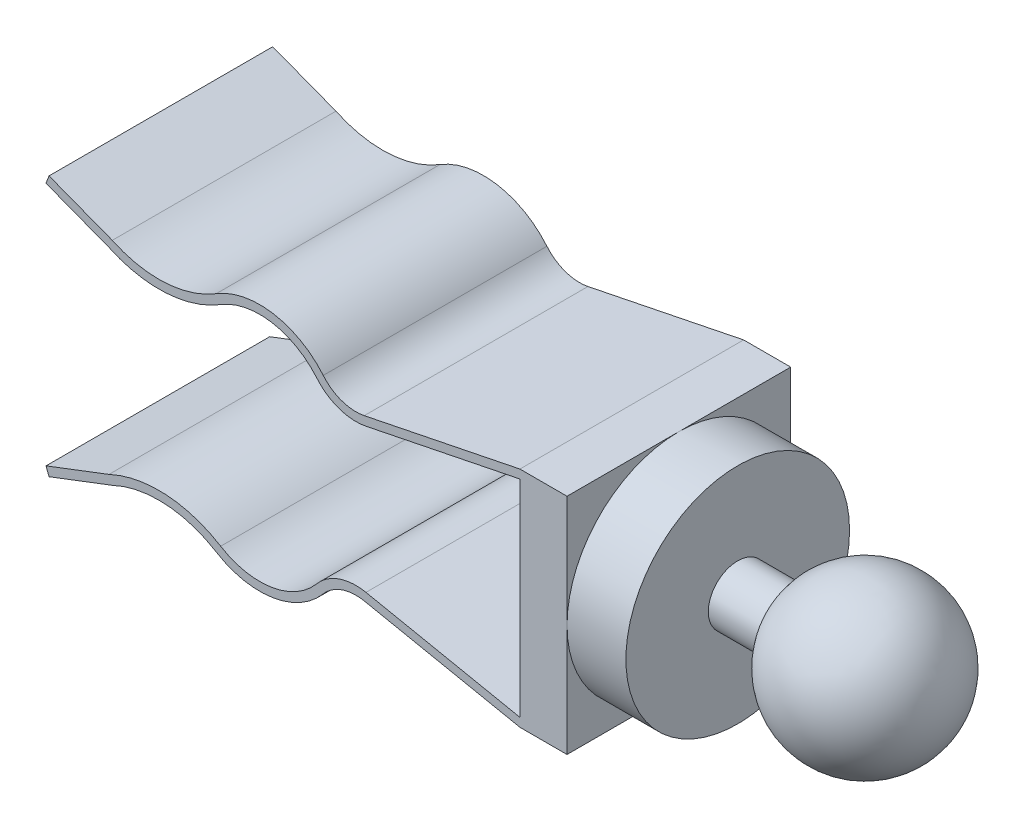
from build123d import *

# Parameters (mm, degrees)
SKETCH2_R           = 6.0325
BOSS_EXTRUDE1_DEPTH = 3.175
SKETCH3_R           = 1.5875
BOSS_EXTRUDE2_DEPTH = 3.175
SKETCH5_W           = 12.065
SKETCH5_H           = 12.065
BOSS_EXTRUDE3_DEPTH = 2.54
BOSS_EXTRUDE4_DEPTH = 6.0325


with BuildPart() as part:
    # Sketch2 → Boss-Extrude1 (new body)
    with BuildSketch(Plane(origin=(0, 0, 0), x_dir=(0, 0, -1), z_dir=(1, 0, 0))):
        Circle(SKETCH2_R)
    extrude(amount=BOSS_EXTRUDE1_DEPTH)

    # Sketch3 → Boss-Extrude2 (add)
    with BuildSketch(Plane(origin=(3.175, 0, 0), x_dir=(0, 0, -1), z_dir=(1, 0, 0))):
        Circle(SKETCH3_R)
    extrude(amount=BOSS_EXTRUDE2_DEPTH)

    # Sketch4 → Revolve1 (revolve)
    with BuildSketch(Plane.XY):
        with BuildLine():
            Line((5.715, 0), (14.351, 0))
            ThreePointArc((14.351, 0), (10.033, 4.318), (5.715, 0))
        make_face()
    revolve(axis=Axis((5.715, 0, 0), (1, 0, 0)))

    # Sketch5 → Boss-Extrude3 (add)
    with BuildSketch(Plane.ZY):
        Rectangle(SKETCH5_W, SKETCH5_H)
    extrude(amount=BOSS_EXTRUDE3_DEPTH)

    # Sketch7 → Boss-Extrude4 (add, symmetric)
    with BuildSketch(Plane.XY):
        with BuildLine():
            Line((-2.54, 6.0325), (-10.935574209, 4.328993713))
            ThreePointArc((-10.935574209, 4.328993713), (-12.148502267, 4.411480747), (-13.149077484, 5.102022434))
            ThreePointArc((-13.149077484, 5.102022434), (-15.862491492, 6.641192846), (-18.922091819, 6.0325))
            ThreePointArc((-18.922091819, 6.0325), (-21.686103075, 5.165714471), (-24.528789325, 5.7226797))
            Line((-24.528789325, 5.7226797), (-27.94, 7.027138907))
            Line((-27.94, 7.027138907), (-28.10330212, 6.600097624))
            Line((-28.10330212, 6.600097624), (-24.708214464, 5.301803917))
            ThreePointArc((-24.708214464, 5.301803917), (-21.651931317, 4.709711596), (-18.682120225, 5.64334004))
            ThreePointArc((-18.682120225, 5.64334004), (-15.935242742, 6.189818173), (-13.499167749, 4.807966919))
            ThreePointArc((-13.499167749, 4.807966919), (-12.299243569, 3.979845601), (-10.844658565, 3.880924315))
            Line((-10.844658565, 3.880924315), (-2.449084356, 5.584430602))
            Line((-2.449084356, 5.584430602), (-2.54, 6.0325))
        make_face()
        with BuildLine():
            Line((-24.528789325, -5.7226797), (-27.94, -7.027138907))
            Line((-27.94, -7.027138907), (-28.10330212, -6.600097624))
            Line((-28.10330212, -6.600097624), (-24.708214464, -5.301803917))
            ThreePointArc((-24.708214464, -5.301803917), (-21.651931317, -4.709711596), (-18.682120225, -5.64334004))
            ThreePointArc((-18.682120225, -5.64334004), (-15.935242742, -6.189818173), (-13.499167749, -4.807966919))
            ThreePointArc((-13.499167749, -4.807966919), (-12.299243569, -3.979845601), (-10.844658565, -3.880924315))
            Line((-10.844658565, -3.880924315), (-2.449084356, -5.584430602))
            Line((-2.449084356, -5.584430602), (-2.54, -6.0325))
            Line((-2.54, -6.0325), (-10.935574209, -4.328993713))
            ThreePointArc((-10.935574209, -4.328993713), (-12.148502267, -4.411480747), (-13.149077484, -5.102022434))
            ThreePointArc((-13.149077484, -5.102022434), (-15.862491492, -6.641192846), (-18.922091819, -6.0325))
            ThreePointArc((-18.922091819, -6.0325), (-21.686103075, -5.165714471), (-24.528789325, -5.7226797))
        make_face()
    extrude(amount=BOSS_EXTRUDE4_DEPTH, both=True)


solid = part.part
